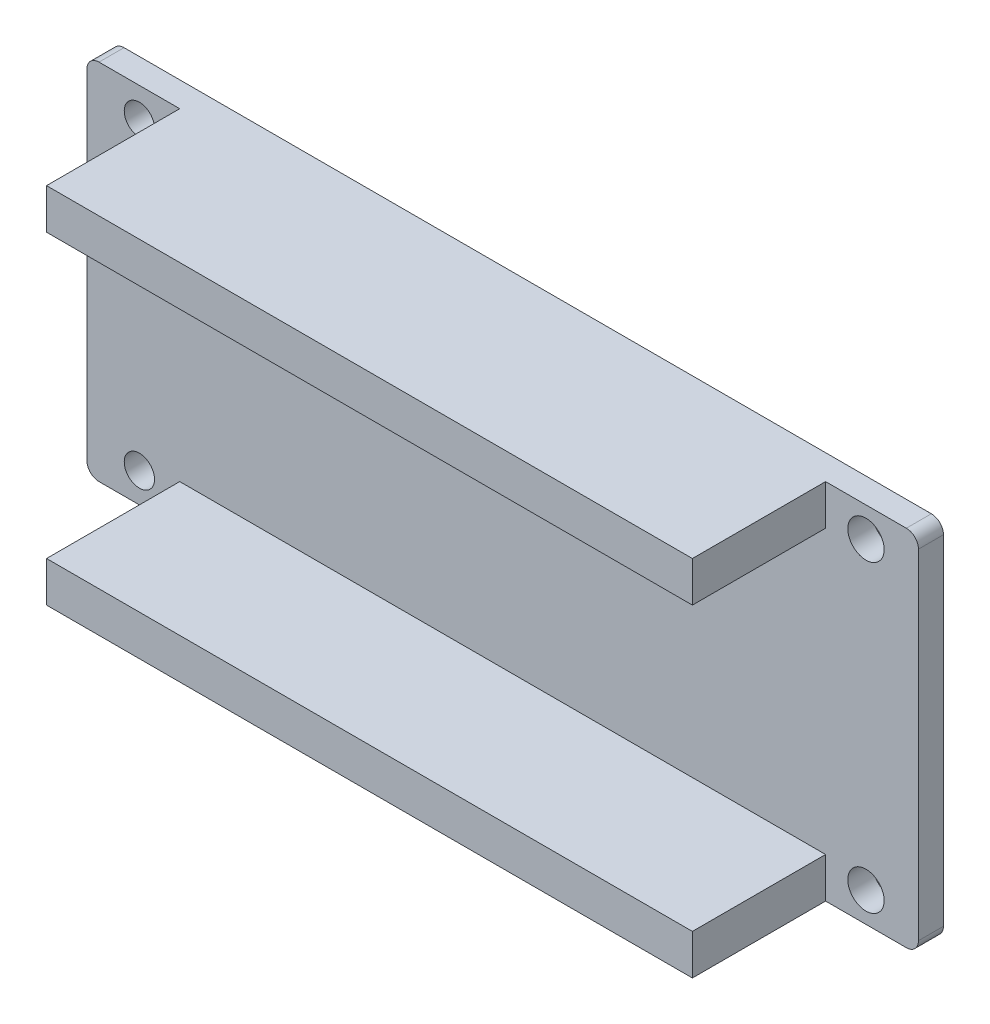
from build123d import *

# Parameters (mm, degrees)
SKETCH1_W           = 52.324
SKETCH1_H           = 22.86
BOSS_EXTRUDE1_DEPTH = 1.5748
SKETCH2_W           = 30.988
SKETCH2_H           = 17.78
BOSS_EXTRUDE2_DEPTH = 2.032
SKETCH3_W           = 40.64
SKETCH3_H           = 2.54
BOSS_EXTRUDE3_DEPTH = 8.382
FILLET1_R           = 0.762
SKETCH4_R           = 1.143
SKETCH4_R_2         = 0.9525
CUT_EXTRUDE1_DEPTH  = 1.5748


with BuildPart() as part:
    # Sketch1 → Boss-Extrude1 (new body)
    with BuildSketch(Plane.XY):
        with Locations((26.162, 11.43)):
            Rectangle(SKETCH1_W, SKETCH1_H)
    extrude(amount=BOSS_EXTRUDE1_DEPTH)

    # Sketch2 → Boss-Extrude2 (add)
    with BuildSketch(Plane(origin=(0, 0, 0), x_dir=(-1, 0, 0), z_dir=(0, 0, -1))):
        with Locations((-28.194, 11.43)):
            Rectangle(SKETCH2_W, SKETCH2_H)
    extrude(amount=BOSS_EXTRUDE2_DEPTH)

    # Sketch3 → Boss-Extrude3 (add)
    with BuildSketch(Plane.XY.offset(1.5748)):
        with Locations((26.162, 21.59)):
            Rectangle(SKETCH3_W, SKETCH3_H)
        with Locations((26.162, 1.27)):
            Rectangle(SKETCH3_W, SKETCH3_H)
    extrude(amount=BOSS_EXTRUDE3_DEPTH)

    # Fillet1
    fillet1_edges = [part.edges().sort_by_distance(p)[0] for p in [
        (0, 22.86, 0.7874),
        (52.324, 22.86, 0.7874),
        (52.324, 0, 0.7874),
        (0, 0, 0.7874),
    ]]
    fillet(fillet1_edges, radius=FILLET1_R)

    # Sketch4 → Cut-Extrude1 (cut)
    with BuildSketch(Plane(origin=(0, 0, 0), x_dir=(-1, 0, 0), z_dir=(0, 0, -1))):
        with Locations((-49.022, 20.9931)):
            Circle(SKETCH4_R)
        with Locations((-3.302, 20.9931)):
            Circle(SKETCH4_R_2)
        with Locations((-3.302, 1.8669)):
            Circle(SKETCH4_R_2)
        with Locations((-49.022, 1.8669)):
            Circle(SKETCH4_R)
    extrude(amount=-CUT_EXTRUDE1_DEPTH, mode=Mode.SUBTRACT)


solid = part.part
